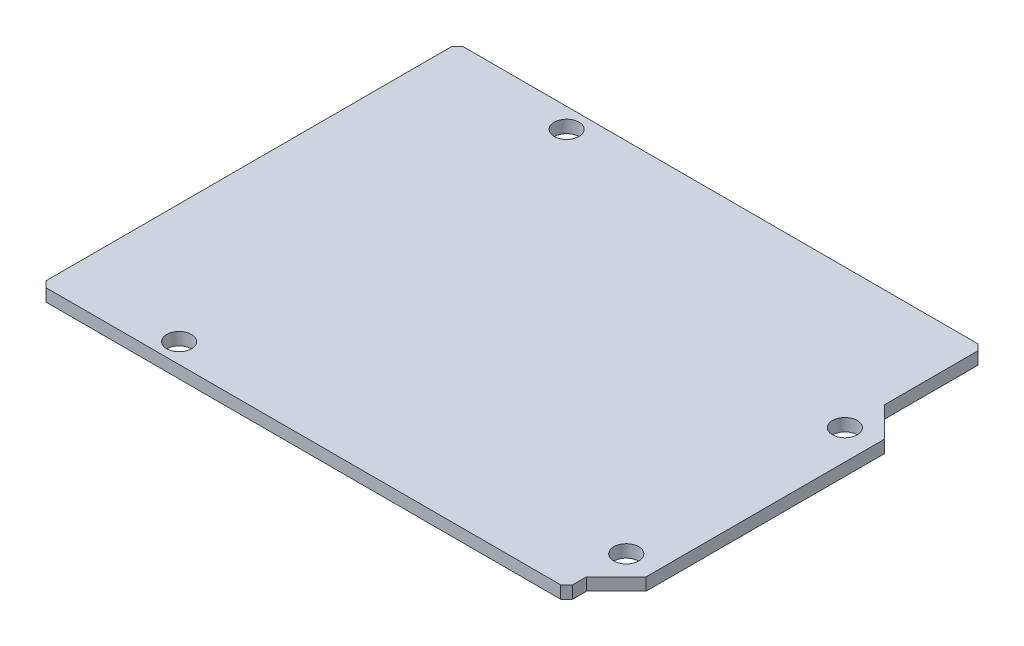
from build123d import *

# Parameters (mm, degrees)
SKETCH1_R           = 1.5875
BOSS_EXTRUDE1_DEPTH = 1.6002
CHAMFER1_SIZE       = 0.762


with BuildPart() as part:
    # Sketch1 → Boss-Extrude1 (new body)
    with BuildSketch(Plane(origin=(0, 0, 0), x_dir=(1, 0, 0), z_dir=(0, 1, 0))):
        Polygon((0, 0), (0, 53.34), (67.31, 53.34), (67.31, 40.64), (71.12, 36.83), (71.12, 6.35), (67.31, 2.54), (67.31, 0), align=None)
        with Locations(Location((16.51, 50.8, 0), (0, 0, 270))):
            Circle(SKETCH1_R, mode=Mode.SUBTRACT)
        with Locations(Location((15.24, 2.54, 0), (0, 0, 270))):
            Circle(SKETCH1_R, mode=Mode.SUBTRACT)
        with Locations(Location((67.31, 35.56, 0), (0, 0, 270))):
            Circle(SKETCH1_R, mode=Mode.SUBTRACT)
        with Locations(Location((67.31, 7.62, 0), (0, 0, 270))):
            Circle(SKETCH1_R, mode=Mode.SUBTRACT)
    extrude(amount=BOSS_EXTRUDE1_DEPTH)

    # Chamfer1
    chamfer1_edges = [part.edges().sort_by_distance(p)[0] for p in [
        (0, 0.8001, 0),
        (0, 0.8001, -53.34),
        (67.31, 0.8001, -53.34),
        (67.31, 0.8001, 0),
    ]]
    chamfer(chamfer1_edges, length=CHAMFER1_SIZE)


solid = part.part
